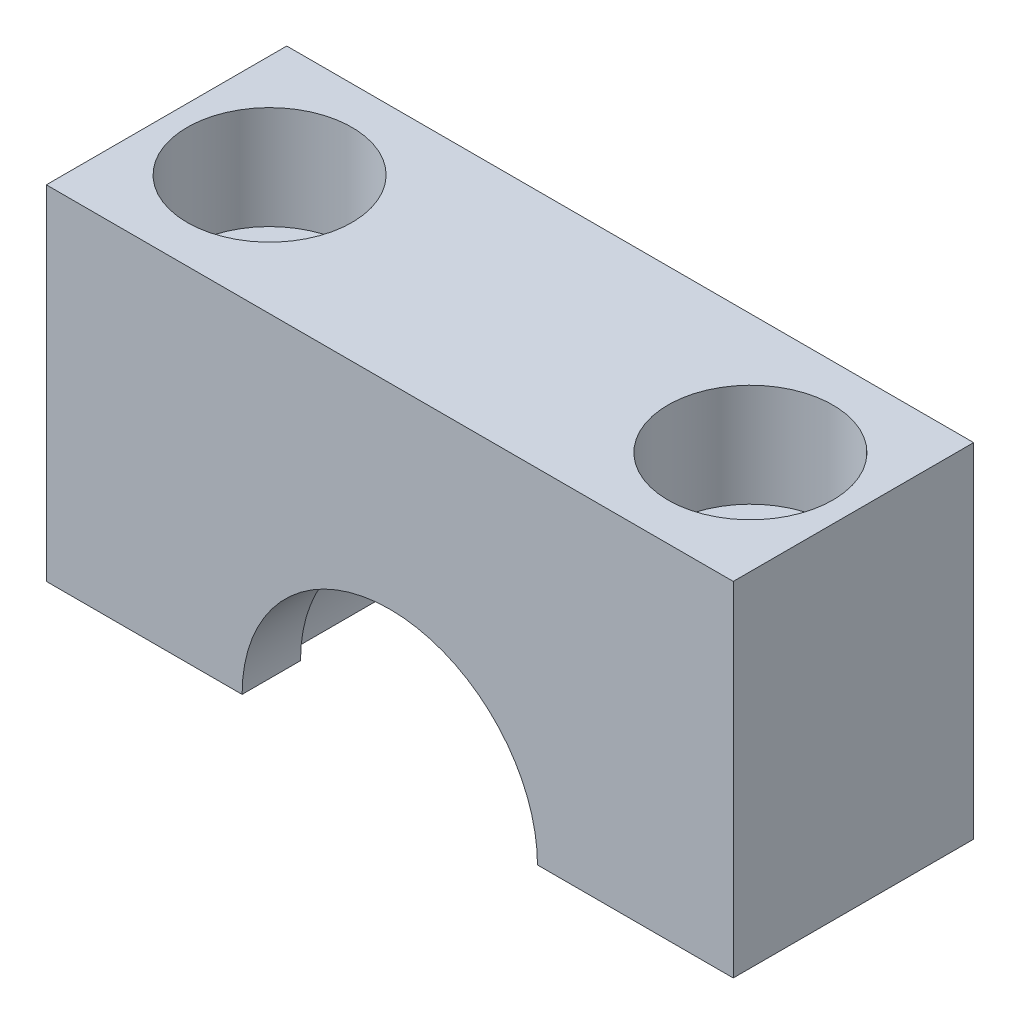
from build123d import *

# Parameters (mm, degrees)
EXTRUDE_1_DEPTH     = 17.5
SKETCH_2_R          = 7.5
CUT_EXTRUDE_1_DEPTH = 73.844011422
SKETCH_3_R          = 12
CUT_EXTRUDE_2_DEPTH = 15
SKETCH_4_R          = 23.5
CUT_EXTRUDE_3_DEPTH = 9


with BuildPart() as part:
    # 草图1 → 凸台-拉伸1 (new, symmetric)
    with BuildSketch(Plane.XY):
        with BuildLine():
            Line((21.5, -25), (50, -25))
            Line((50, -25), (50, 25))
            Line((50, 25), (-50, 25))
            Line((-50, 25), (-50, -25))
            Line((-50, -25), (-21.5, -25))
            ThreePointArc((-21.5, -25), (0, -3.5), (21.5, -25))
        make_face()
    extrude(amount=EXTRUDE_1_DEPTH, both=True)

    # 草图2 → 切除-拉伸1 (cut, through all)
    with BuildSketch(Plane(origin=(0, 25, 0), x_dir=(1, 0, 0), z_dir=(0, 1, 0))):
        with Locations(Location((-35, 0, 0), (0, 0, 270))):
            Circle(SKETCH_2_R)
        with Locations(Location((35, 0, 0), (0, 0, 270))):
            Circle(SKETCH_2_R)
    extrude(amount=-CUT_EXTRUDE_1_DEPTH, mode=Mode.SUBTRACT)

    # 草图3 → 切除-拉伸2 (cut)
    with BuildSketch(Plane(origin=(0, 25, 0), x_dir=(1, 0, 0), z_dir=(0, 1, 0))):
        with Locations(Location((-35, 0, 0), (0, 0, 270))):
            Circle(SKETCH_3_R)
        with Locations(Location((35, 0, 0), (0, 0, 270))):
            Circle(SKETCH_3_R)
    extrude(amount=-CUT_EXTRUDE_2_DEPTH, mode=Mode.SUBTRACT)

    # 草图4 → 切除-拉伸3 (cut, symmetric)
    with BuildSketch(Plane.XY):
        with Locations((0, -25)):
            Circle(SKETCH_4_R)
    extrude(amount=CUT_EXTRUDE_3_DEPTH, both=True, mode=Mode.SUBTRACT)


solid = part.part
